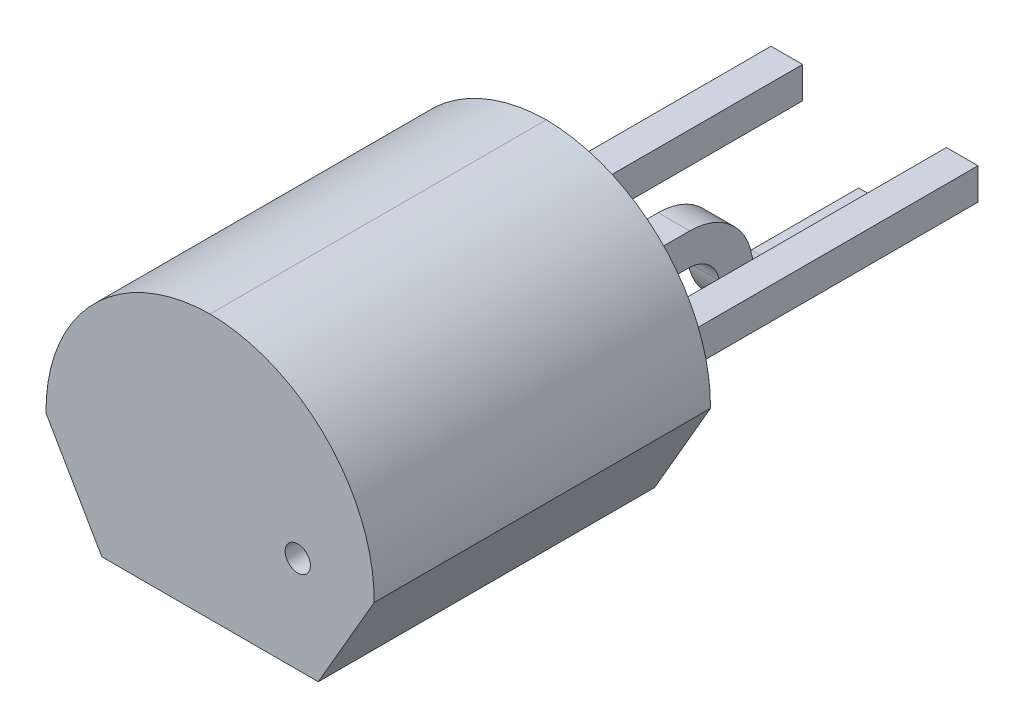
from build123d import *

# Parameters (mm, degrees)
EXTRUDE_1_DEPTH     = 5.33
SKETCH_1_W          = 0.5
SKETCH_1_H          = 0.5
EXTRUDE_2_DEPTH     = 2.54
SKETCH_1_2_W        = 0.5
SKETCH_1_2_H        = 0.5
EXTRUDE_3_DEPTH     = 10.16
SKETCH_4_R          = 0.2
CUT_EXTRUDE_1_DEPTH = 0.5
SKETCH_5_W          = 0.5
SKETCH_5_H          = 10.2
EXTRUDE_4_DEPTH     = 1.25
CUT_EXTRUDE_2_DEPTH = 1
FILLET_1_R          = 0.5
FILLET_2_R          = 1
SKETCH_7_W          = 0.5
SKETCH_7_H          = 0.5
CUT_EXTRUDE_3_DEPTH = 7.5
SKETCH_8_R          = 0.124451118
CUT_EXTRUDE_4_DEPTH = 1


with BuildPart() as part:
    # Эскиз3 → Вытянуть1 (new body)
    with BuildSketch(Plane.XY.offset(2.54)):
        with BuildLine():
            Line((-0.325, -1.53), (3.105, -1.53))
            Line((3.105, -1.53), (3.99, 0))
            ThreePointArc((3.99, 0), (3.240904038, 1.868477631), (1.39, 2.66))
            ThreePointArc((1.39, 2.66), (-0.460904038, 1.868477631), (-1.21, 0))
            Line((-1.21, 0), (-0.325, -1.53))
        make_face()
    extrude(amount=EXTRUDE_1_DEPTH)

    # Эскиз1 → Вытянуть2 (add)
    with BuildSketch(Plane.XY):
        with Locations((1.39, 0)):
            Rectangle(SKETCH_1_W, SKETCH_1_H)
        Rectangle(SKETCH_1_W, SKETCH_1_H)
        with Locations((2.78, 0)):
            Rectangle(SKETCH_1_W, SKETCH_1_H)
    extrude(amount=EXTRUDE_2_DEPTH)

    # Эскиз1<2> → Вытянуть3 (add)
    with BuildSketch(Plane.XY):
        with Locations((1.39, 0)):
            Rectangle(SKETCH_1_2_W, SKETCH_1_2_H)
        Rectangle(SKETCH_1_2_W, SKETCH_1_2_H)
        with Locations((2.78, 0)):
            Rectangle(SKETCH_1_2_W, SKETCH_1_2_H)
    extrude(amount=-EXTRUDE_3_DEPTH)

    # Эскиз4 → Вырез-Вытянуть1 (cut)
    with BuildSketch(Plane.XY.offset(7.87)):
        with Locations((2.78, 0)):
            Circle(SKETCH_4_R)
    extrude(amount=-CUT_EXTRUDE_1_DEPTH, mode=Mode.SUBTRACT)

    # Эскиз5 → Вытянуть4 (add)
    with BuildSketch(Plane(origin=(0, -0.25, 0), x_dir=(1, 0, 0), z_dir=(0, 1, 0))):
        with Locations((1.39, 5.06)):
            Rectangle(SKETCH_5_W, SKETCH_5_H)
    extrude(amount=-EXTRUDE_4_DEPTH)

    # Эскиз6 → Вырез-Вытянуть2 (cut)
    with BuildSketch(Plane(origin=(1.64, 0, 0), x_dir=(0, 0, -1), z_dir=(1, 0, 0))):
        with BuildLine():
            Line((2.46, -1), (10.787068804, -1))
            Line((10.787068804, -1), (10.787068804, 0.83850211))
            Line((10.787068804, 0.83850211), (10.787068804, 2.125358058))
            Line((10.787068804, 2.125358058), (2.46, 2.125358058))
            Line((2.46, 2.125358058), (0.46, 2.125358058))
            Line((0.46, 2.125358058), (0.46, -0.5))
            ThreePointArc((0.46, -0.5), (0.606446609, -0.853553391), (0.96, -1))
            Line((0.96, -1), (2.46, -1))
        make_face()
    extrude(amount=-CUT_EXTRUDE_2_DEPTH, mode=Mode.SUBTRACT)

    # Скругление1
    fillet_1_edges = [part.edges().sort_by_distance(p)[0] for p in [
        (1.39, -0.25, 0.04),
    ]]
    fillet(fillet_1_edges, radius=FILLET_1_R)

    # Скругление2
    fillet_2_edges = [part.edges().sort_by_distance(p)[0] for p in [
        (1.39, -1.5, 0.04),
        (1.39, 0.25, -0.46),
    ]]
    fillet(fillet_2_edges, radius=FILLET_2_R)

    # Эскиз7 → Вырез-Вытянуть3 (cut)
    with BuildSketch(Plane(origin=(0, 0, -10.16), x_dir=(-1, 0, 0), z_dir=(0, 0, -1))):
        with Locations((-1.39, -1.25)):
            Rectangle(SKETCH_7_W, SKETCH_7_H)
        Rectangle(SKETCH_7_W, SKETCH_7_H)
        with Locations((-2.78, 0)):
            Rectangle(SKETCH_7_W, SKETCH_7_H)
    extrude(amount=-CUT_EXTRUDE_3_DEPTH, mode=Mode.SUBTRACT)

    # Эскиз8 → Вырез-Вытянуть4 (cut)
    with BuildSketch(Plane(origin=(0, 0, -2.66), x_dir=(-1, 0, 0), z_dir=(0, 0, -1))):
        with Locations((-1.39, -1.25)):
            Circle(SKETCH_8_R)
    extrude(amount=-CUT_EXTRUDE_4_DEPTH, mode=Mode.SUBTRACT)


solid = part.part
